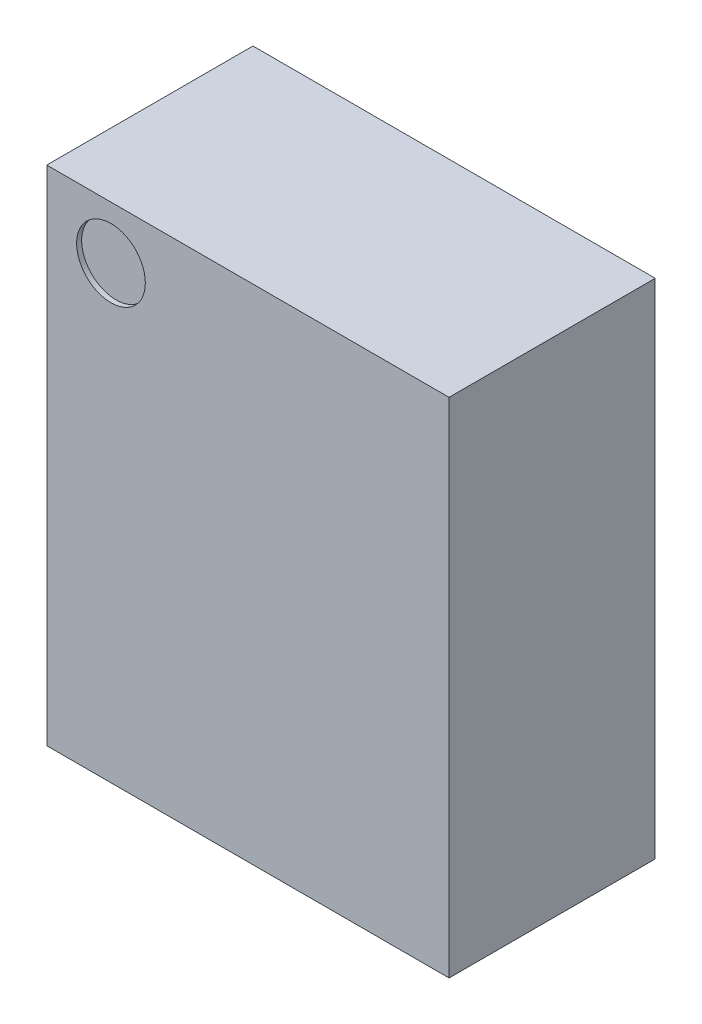
from build123d import *

# Parameters (mm, degrees)
SKETCH1_W           = 1.6
SKETCH1_H           = 2
BOSS_EXTRUDE1_DEPTH = 0.82
SKETCH2_R           = 0.136611136
CUT_EXTRUDE1_DEPTH  = 0.02
BOSS_EXTRUDE2_START = -0.82
SKETCH3_W           = 0.55
SKETCH3_H           = 0.35
BOSS_EXTRUDE2_DEPTH = 0.02


with BuildPart() as part:
    # Sketch1 → Boss-Extrude1 (new body)
    with BuildSketch(Plane.XY):
        Rectangle(SKETCH1_W, SKETCH1_H)
    extrude(amount=BOSS_EXTRUDE1_DEPTH)

    # Sketch2 → Cut-Extrude1 (cut)
    with BuildSketch(Plane.XY.offset(0.82)):
        with Locations((-0.544602285, 0.78988591)):
            Circle(SKETCH2_R)
    extrude(amount=-CUT_EXTRUDE1_DEPTH, mode=Mode.SUBTRACT)

    # Sketch3 → Boss-Extrude2 (add)
    with BuildSketch(Plane.XY.offset(0.82).offset(BOSS_EXTRUDE2_START)):
        with Locations((0.475, 0.8)):
            Rectangle(SKETCH3_W, SKETCH3_H)
        Polygon((-0.75, 0.625), (-0.75, 0.825), (-0.6, 0.975), (-0.2, 0.975), (-0.2, 0.625), (-0.2, 0.525), (-0.75, 0.525), align=None)
        with Locations((-0.475, -0.8)):
            Rectangle(SKETCH3_W, SKETCH3_H)
        with Locations((0.475, -0.8)):
            Rectangle(SKETCH3_W, SKETCH3_H)
    extrude(amount=-BOSS_EXTRUDE2_DEPTH)


solid = part.part
